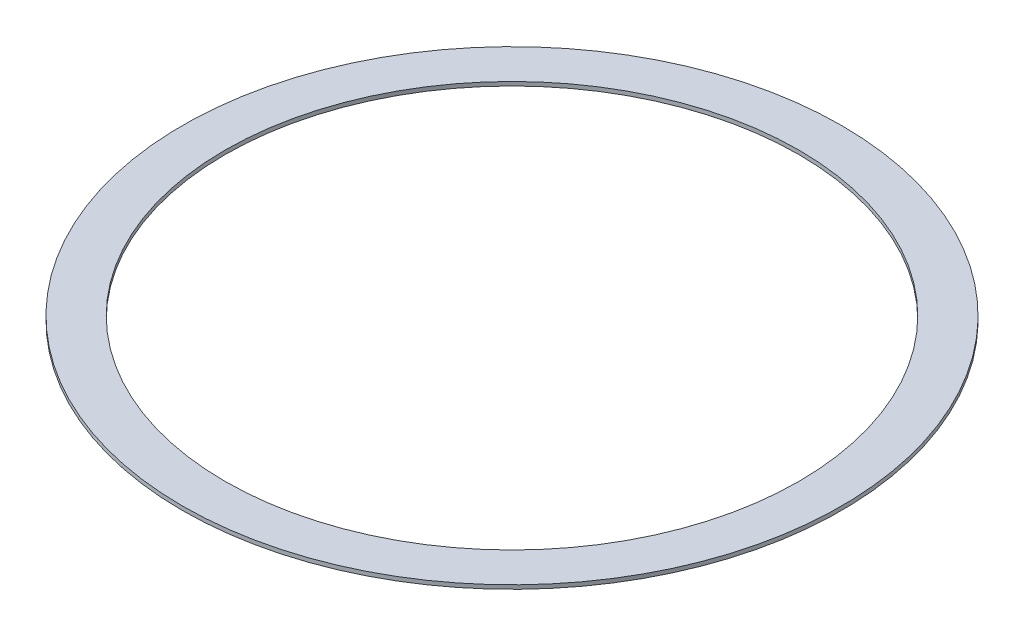
from build123d import *

# Parameters (mm, degrees)
SKETCH1_R           = 63.8175
SKETCH1_R_2         = 55.5625
BOSS_EXTRUDE2_DEPTH = 0.762


with BuildPart() as part:
    # Sketch1 → Boss-Extrude2 (new body)
    with BuildSketch(Plane(origin=(0, 0, 0), x_dir=(1, 0, 0), z_dir=(0, 1, 0))):
        with Locations(Location((0, 0, 0), (0, 0, 90))):
            Circle(SKETCH1_R)
        with Locations(Location((0, 0, 0), (0, 0, 90))):
            Circle(SKETCH1_R_2, mode=Mode.SUBTRACT)
    extrude(amount=BOSS_EXTRUDE2_DEPTH)


solid = part.part
